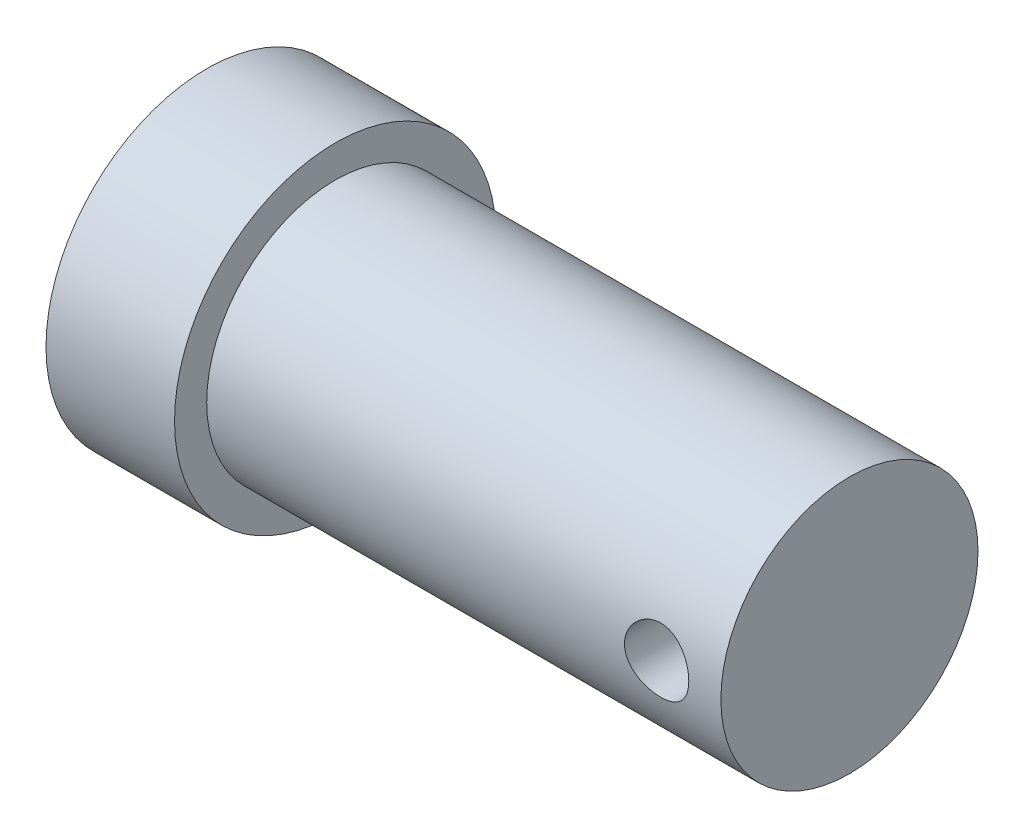
from build123d import *

# Parameters (mm, degrees)
IZIM2_R               = 5
KES_EKSTR_ZYON1_DEPTH = 20


with BuildPart() as part:
    # Çizim1 → Döndür1 (revolve)
    with BuildSketch(Plane.XY, mode=Mode.PRIVATE) as d_nd_r1_sk:
        Polygon((0, 0), (0, 25), (20, 25), (20, 20), (100, 20), (100, 0), align=None)
    revolve(d_nd_r1_sk.sketch.rotate(Axis((0, 0, 0), (1, 0, 0)), 90), axis=Axis((0, 0, 0), (1, 0, 0)))

    # Çizim2 → Kes-Ekstrüzyon1 (cut, symmetric)
    with BuildSketch(Plane.XY):
        with Locations((90, 0)):
            Circle(IZIM2_R)
    extrude(amount=KES_EKSTR_ZYON1_DEPTH, both=True, mode=Mode.SUBTRACT)


solid = part.part
